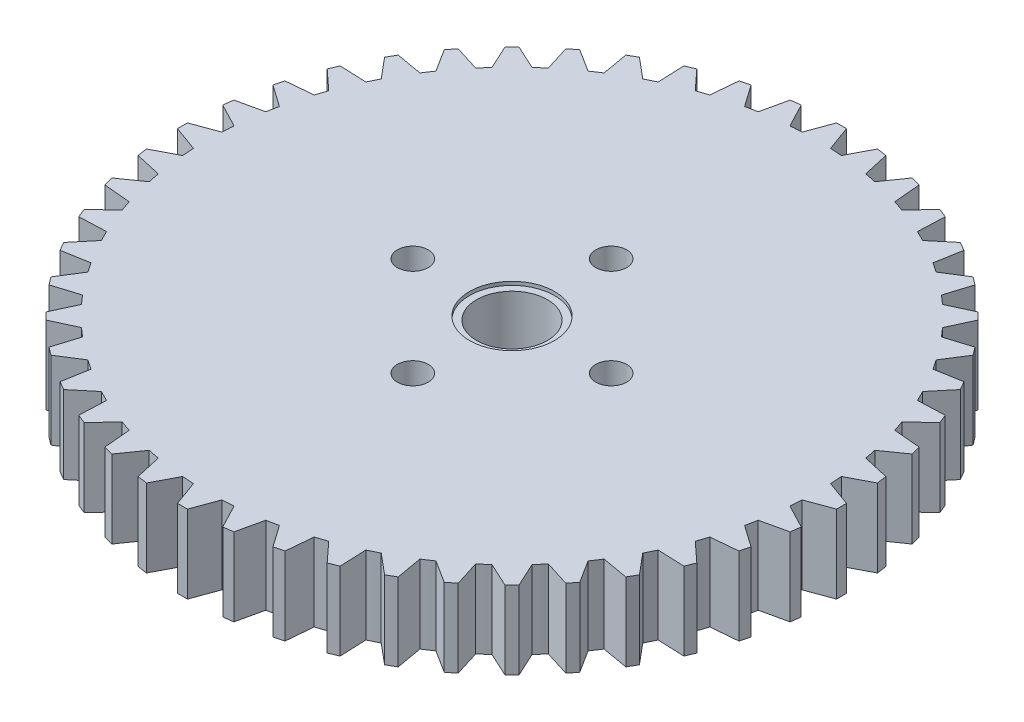
from build123d import *

# Parameters (mm, degrees)
SKETCH2_R           = 21.5
SKETCH2_R_2         = 2.5
BOSS_EXTRUDE1_DEPTH = 5.5
BOSS_EXTRUDE2_START = -3
BOSS_EXTRUDE2_DEPTH = 5.5
CIRPATTERN1_COUNT   = 48
CUT_EXTRUDE1_START  = -0.25
SKETCH4_R           = 3
SKETCH4_R_2         = 2.5
CUT_EXTRUDE1_DEPTH  = 0.25
SKETCH5_R           = 1.09
CUT_EXTRUDE2_DEPTH  = 5.5
CIRPATTERN2_COUNT   = 4


with BuildPart() as part:
    # Sketch2 → Boss-Extrude1 (new body)
    with BuildSketch(Plane(origin=(0, 0, 0), x_dir=(1, 0, 0), z_dir=(0, 1, 0))):
        with Locations(Location((0, 0, 0), (0, 0, 270))):
            Circle(SKETCH2_R)
        with Locations(Location((0, 0, 0), (0, 0, 270))):
            Circle(SKETCH2_R_2, mode=Mode.SUBTRACT)
    extrude(amount=BOSS_EXTRUDE1_DEPTH)

    # Sketch3 → Boss-Extrude2 (add)
    with BuildSketch(Plane(origin=(0, 3, 0), x_dir=(1, 0, 0), z_dir=(0, 1, 0)).offset(BOSS_EXTRUDE2_START)):
        with BuildLine():
            Line((-1, 21.476731595), (-0.35, 23.25))
            Line((-0.35, 23.25), (0.35, 23.25))
            Line((0.35, 23.25), (1, 21.476731595))
            ThreePointArc((1, 21.476731595), (0, 21.5), (-1, 21.476731595))
        make_face()
    boss_extrude2 = extrude(amount=BOSS_EXTRUDE2_DEPTH)

    # CirPattern1: Boss-Extrude2 ×48 about axis
    cirpattern1_axis = Axis((0, 0, 0), (0, 1, 0))
    for i in range(1, CIRPATTERN1_COUNT):
        add(boss_extrude2.rotate(cirpattern1_axis, i * 360 / CIRPATTERN1_COUNT))

    # Sketch4 → Cut-Extrude1 (cut)
    with BuildSketch(Plane(origin=(0, 5.5, 0), x_dir=(1, 0, 0), z_dir=(0, 1, 0)).offset(CUT_EXTRUDE1_START)):
        with Locations(Location((0, 0, 0), (0, 0, 270))):
            Circle(SKETCH4_R)
        with Locations(Location((0, 0, 0), (0, 0, 270))):
            Circle(SKETCH4_R_2, mode=Mode.SUBTRACT)
    extrude(amount=CUT_EXTRUDE1_DEPTH, mode=Mode.SUBTRACT)

    # Sketch5 → Cut-Extrude2 (cut)
    with BuildSketch(Plane(origin=(0, 5.5, 0), x_dir=(1, 0, 0), z_dir=(0, 1, 0))):
        with Locations(Location((0, 7, 0), (0, 0, 270))):
            Circle(SKETCH5_R)
    cut_extrude2 = extrude(amount=-CUT_EXTRUDE2_DEPTH, mode=Mode.SUBTRACT)

    # CirPattern2: Cut-Extrude2 ×4 about axis
    cirpattern2_axis = Axis((0, 0, 0), (0, 1, 0))
    for i in range(1, CIRPATTERN2_COUNT):
        add(cut_extrude2.rotate(cirpattern2_axis, i * 360 / CIRPATTERN2_COUNT), mode=Mode.SUBTRACT)


solid = part.part
